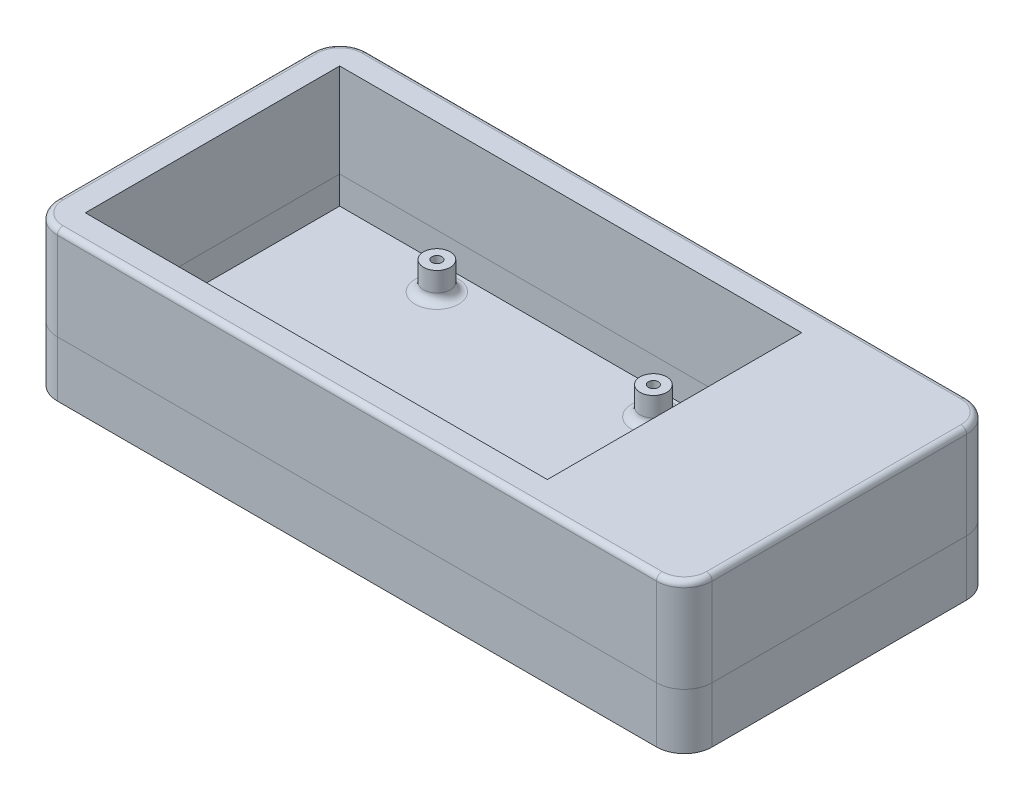
from build123d import *

# Parameters (mm, degrees)
BOSS_EXTRUDE2_DEPTH    = 26.8
SKETCH2_W              = 107.6
SKETCH2_H              = 45.69
CUT_EXTRUDE2_DEPTH     = 21.8
SKETCH3_R              = 2.4
SKETCH3_R_2            = 0.9
BOSS_EXTRUDE3_DEPTH    = 5
FILLET3_R              = 1
FILLET5_R              = 1.5
FILLET6_R              = 1.5
FILLET7_R              = 1.5
BOSS_EXTRUDE4_REACH    = 91.152
SKETCH10_W             = 24.61
SKETCH10_H             = 5
CUT_EXTRUDE3_DEPTH     = 5
SPLIT1_SURFACE_1_BACK  = 133.851
SPLIT1_SURFACE_1_DEPTH = 267.702
SPLIT1_SURFACE_2_BACK  = 133.851
SPLIT1_SURFACE_2_DEPTH = 267.702


with BuildPart() as part:
    # Sketch1 → Boss-Extrude2 (new body)
    with BuildSketch(Plane(origin=(0, 0, 0), x_dir=(1, 0, 0), z_dir=(0, 1, 0))):
        with BuildLine():
            Line((-44.333718436, 25.104825802), (63.266281564, 25.104825802))
            ThreePointArc((63.266281564, 25.104825802), (66.80181547, 23.640359708), (68.266281564, 20.104825802))
            Line((68.266281564, 20.104825802), (68.266281564, -25.585174198))
            ThreePointArc((68.266281564, -25.585174198), (66.80181547, -29.120708104), (63.266281564, -30.585174198))
            Line((63.266281564, -30.585174198), (-44.333718436, -30.585174198))
            ThreePointArc((-44.333718436, -30.585174198), (-47.869252342, -29.120708104), (-49.333718436, -25.585174198))
            Line((-49.333718436, -25.585174198), (-49.333718436, 20.104825802))
            ThreePointArc((-49.333718436, 20.104825802), (-47.869252342, 23.640359708), (-44.333718436, 25.104825802))
        make_face()
    extrude(amount=BOSS_EXTRUDE2_DEPTH)

    # Sketch2 → Cut-Extrude2 (cut)
    with BuildSketch(Plane(origin=(0, 26.8, 0), x_dir=(1, 0, 0), z_dir=(0, 1, 0))):
        with Locations((9.466281564, -2.740174198)):
            Rectangle(SKETCH2_W, SKETCH2_H)
    extrude(amount=-CUT_EXTRUDE2_DEPTH, mode=Mode.SUBTRACT)

    # Sketch3 → Boss-Extrude3 (add)
    # profile 1 of 3: a face of its own
    with BuildSketch(Plane(origin=(0, 5, 0), x_dir=(1, 0, 0), z_dir=(0, 1, 0))):
        with Locations(Location((-22.283718436, 15.514825802, 0), (0, 0, 270))):
            Circle(SKETCH3_R)
        with Locations(Location((-22.283718436, 15.514825802, 0), (0, 0, 270))):
            Circle(SKETCH3_R_2, mode=Mode.SUBTRACT)
    # profile 2 of 3: a face of its own
    with BuildSketch(Plane(origin=(0, 5, 0), x_dir=(1, 0, 0), z_dir=(0, 1, 0))):
        with Locations(Location((16.606281564, 15.514825802, 0), (0, 0, 270))):
            Circle(SKETCH3_R)
        with Locations(Location((16.606281564, 15.514825802, 0), (0, 0, 270))):
            Circle(SKETCH3_R_2, mode=Mode.SUBTRACT)
    # profile 3 of 3: a face of its own
    with BuildSketch(Plane(origin=(0, 5, 0), x_dir=(1, 0, 0), z_dir=(0, 1, 0))):
        with Locations(Location((-2.443718436, -20.995174198, 0), (0, 0, 270))):
            Circle(SKETCH3_R)
        with Locations(Location((-2.443718436, -20.995174198, 0), (0, 0, 270))):
            Circle(SKETCH3_R_2, mode=Mode.SUBTRACT)
    extrude(amount=BOSS_EXTRUDE3_DEPTH)

    # Fillet3
    fillet3_edges = [part.edges().sort_by_distance(p)[0] for p in [
        (66.80181547, 26.8, -23.640359708),
        (68.266281564, 26.8, 2.740174198),
        (66.80181547, 26.8, 29.120708104),
        (9.466281564, 26.8, 30.585174198),
        (-47.869252342, 26.8, 29.120708104),
        (-49.333718436, 26.8, 2.740174198),
        (-47.869252342, 26.8, -23.640359708),
        (9.466281564, 26.8, -25.104825802),
    ]]
    fillet(fillet3_edges, radius=FILLET3_R)

    # Fillet5
    fillet5_edges = [part.edges().sort_by_distance(p)[0] for p in [
        (16.606281564, 5, -17.914825802),
    ]]
    fillet(fillet5_edges, radius=FILLET5_R)

    # Fillet6
    fillet6_edges = [part.edges().sort_by_distance(p)[0] for p in [
        (-22.283718436, 5, -17.914825802),
    ]]
    fillet(fillet6_edges, radius=FILLET6_R)

    # Fillet7
    fillet7_edges = [part.edges().sort_by_distance(p)[0] for p in [
        (-2.443718436, 5, 18.595174198),
    ]]
    fillet(fillet7_edges, radius=FILLET7_R)

    # Sketch10 → Boss-Extrude4 (add, up to next)
    with BuildSketch(Plane.XY.offset(-20.104825802), mode=Mode.PRIVATE) as boss_extrude4_sk1:
        with Locations((50.961281564, 24.3)):
            Rectangle(SKETCH10_W, SKETCH10_H)
    boss_extrude4_tool1 = extrude(boss_extrude4_sk1.sketch, amount=BOSS_EXTRUDE4_REACH, mode=Mode.PRIVATE) - part.part
    add(boss_extrude4_tool1.solids().sort_by_distance((50.961282, 24.3, -20.104826))[0])

    # Sketch13 → Cut-Extrude3 (cut)
    with BuildSketch(Plane.XY.offset(-20.104825802)):
        with BuildLine():
            Line((42.626281564, 11), (52.626281564, 11))
            ThreePointArc((52.626281564, 11), (52.979834955, 10.853553391), (53.126281564, 10.5))
            Line((53.126281564, 10.5), (53.126281564, 7.2))
            ThreePointArc((53.126281564, 7.2), (52.979834955, 6.846446609), (52.626281564, 6.7))
            Line((52.626281564, 6.7), (42.626281564, 6.7))
            ThreePointArc((42.626281564, 6.7), (42.272728174, 6.846446609), (42.126281564, 7.2))
            Line((42.126281564, 7.2), (42.126281564, 10.5))
            ThreePointArc((42.126281564, 10.5), (42.272728174, 10.853553391), (42.626281564, 11))
        make_face()
    extrude(amount=-CUT_EXTRUDE3_DEPTH, mode=Mode.SUBTRACT)


with BuildPart() as body_2:
    # Split1: the piece behind the surface
    add(part.part)
    # Split1 surface: a surface, the sketch's curves swept straight by 267.702 mm
    with BuildLine(Plane.XY.offset(-20.104825802).offset(-SPLIT1_SURFACE_1_BACK), mode=Mode.PRIVATE) as split1_surface_1_path:
        Line((-49.333718436, 10), (68.266281564, 10))
    split1_surface_1 = Shell.extrude(split1_surface_1_path.wire(), (0 * SPLIT1_SURFACE_1_DEPTH, 0 * SPLIT1_SURFACE_1_DEPTH, 1 * SPLIT1_SURFACE_1_DEPTH))
    split(bisect_by=split1_surface_1, keep=Keep.BOTTOM)


with BuildPart() as part_1:
    add(part.part)

    # Split1: split by a surface, the side it looks to stays
    # Split1 surface: a surface, the sketch's curves swept straight by 267.702 mm
    with BuildLine(Plane.XY.offset(-20.104825802).offset(-SPLIT1_SURFACE_2_BACK), mode=Mode.PRIVATE) as split1_surface_2_path:
        Line((-49.333718436, 10), (68.266281564, 10))
    split1_surface_2 = Shell.extrude(split1_surface_2_path.wire(), (0 * SPLIT1_SURFACE_2_DEPTH, 0 * SPLIT1_SURFACE_2_DEPTH, 1 * SPLIT1_SURFACE_2_DEPTH))
    split(bisect_by=split1_surface_2, keep=Keep.TOP)


solid = Compound([body_2.part, part_1.part])
